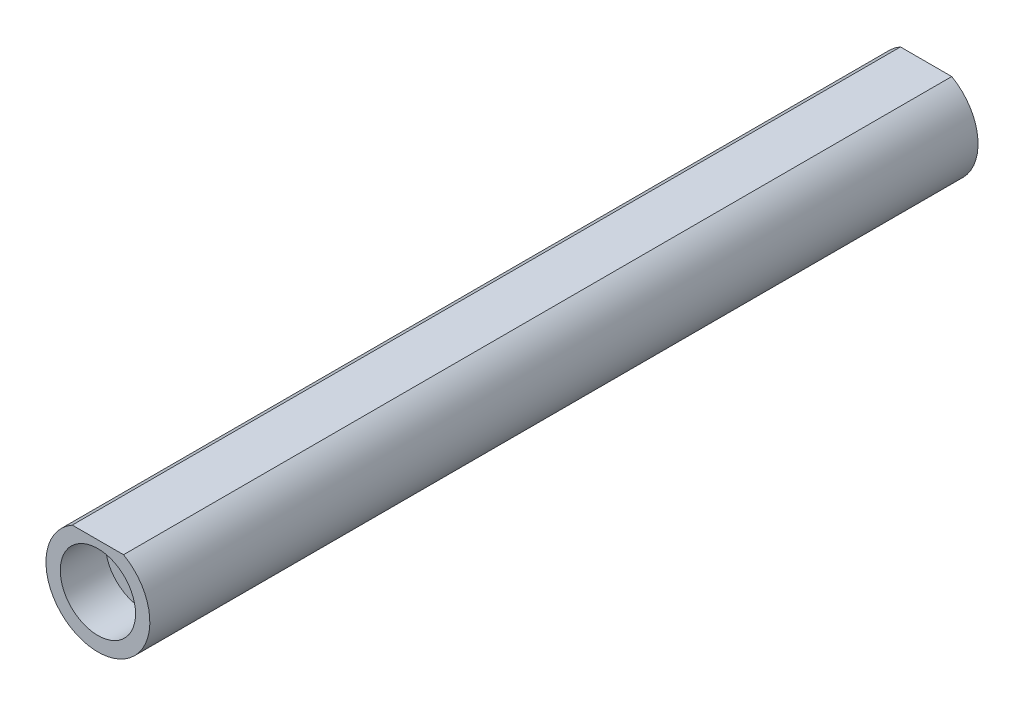
from build123d import *

# Parameters (mm, degrees)
BOSS_EXTRUDE2_DEPTH = 55
SKETCH2_R           = 2.5
CUT_EXTRUDE1_DEPTH  = 3


with BuildPart() as part:
    # Sketch1 → Boss-Extrude2 (new body)
    with BuildSketch(Plane.XY):
        with BuildLine():
            Line((-1.703672504, 3), (1.703672504, 3))
            ThreePointArc((1.703672504, 3), (0, -3.45), (-1.703672504, 3))
        make_face()
    extrude(amount=BOSS_EXTRUDE2_DEPTH)

    # Sketch2 → Cut-Extrude1 (cut)
    with BuildSketch(Plane.XY.offset(55)):
        Circle(SKETCH2_R)
    extrude(amount=-CUT_EXTRUDE1_DEPTH, mode=Mode.SUBTRACT)


solid = part.part
